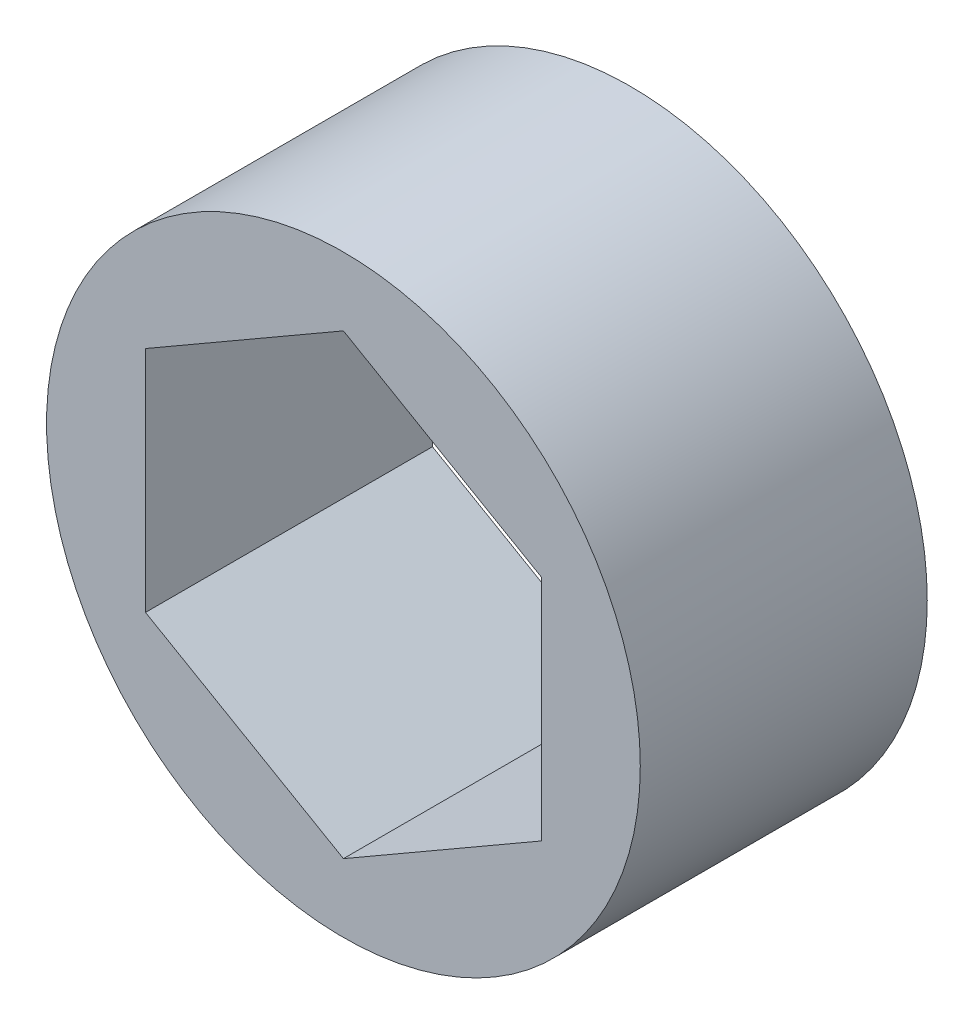
from build123d import *

# Parameters (mm, degrees)
SKETCH2_R           = 9.525
BOSS_EXTRUDE1_DEPTH = 9.2075


with BuildPart() as part:
    # Sketch2 → Boss-Extrude1 (new body)
    with BuildSketch(Plane.XY):
        Circle(SKETCH2_R)
        Polygon((6.35, 3.666174209), (0, 7.332348419), (-6.35, 3.666174209), (-6.35, -3.666174209), (0, -7.332348419), (6.35, -3.666174209), align=None, mode=Mode.SUBTRACT)
    extrude(amount=BOSS_EXTRUDE1_DEPTH)


solid = part.part
